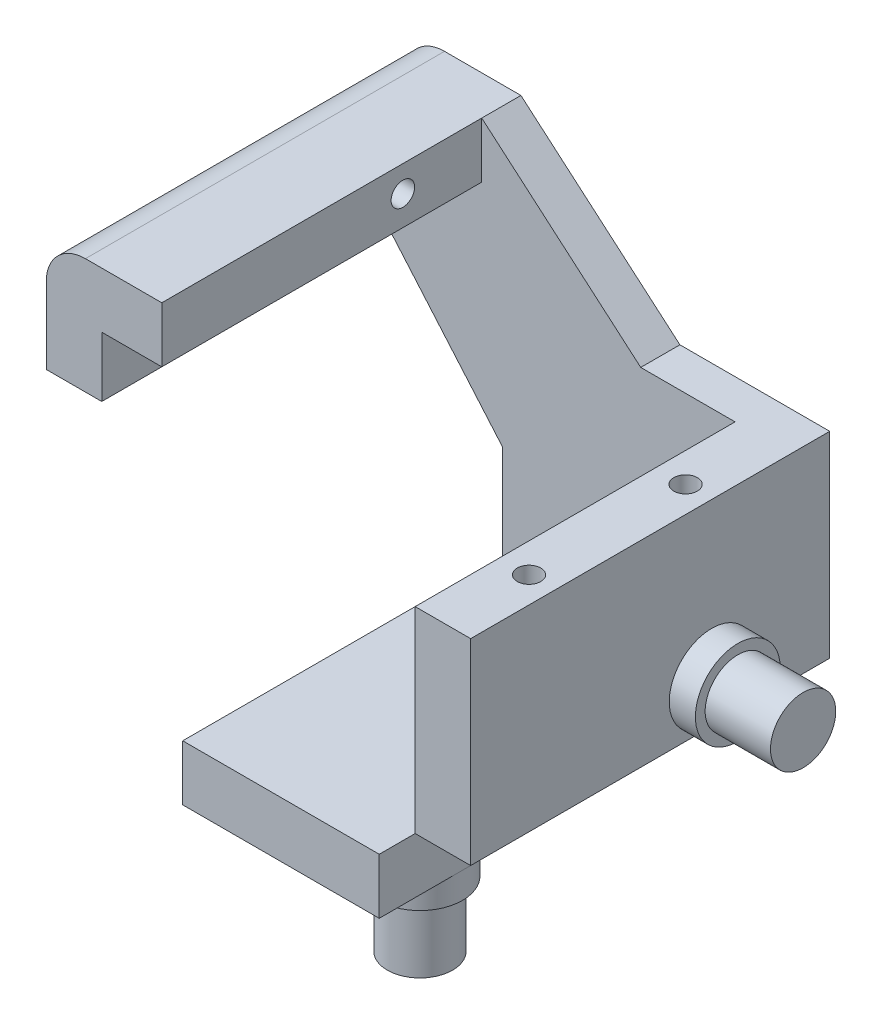
from build123d import *

# Parameters (mm, degrees)
EXTRUDE_1_DEPTH      = 27.5
SKETCH_3_W           = 24
SKETCH_3_H           = 24
CUT_EXTRUDE_3_DEPTH  = 24.5
CUT_EXTRUDE_4_DEPTH  = 24.5
SKETCH_7_R           = 3.25
EXTRUDE_4_DEPTH      = 2
SKETCH_10_R          = 3.25
EXTRUDE_5_DEPTH      = 2
CUT_EXTRUDE_6_DEPTH  = 27.5
CUT_EXTRUDE_7_DEPTH  = 3
SKETCH_16_R          = 0.9
CUT_EXTRUDE_10_DEPTH = 6
SKETCH_20_R          = 2.5
EXTRUDE_6_DEPTH      = 5
SKETCH_19_R          = 2.5
EXTRUDE_7_DEPTH      = 5
SKETCH_17_R          = 0.9
CUT_EXTRUDE_11_DEPTH = 6
SKETCH_21_R          = 0.9
CUT_EXTRUDE_12_DEPTH = 6


with BuildPart() as part:
    # 草图1 → 凸台-拉伸1 (new body)
    with BuildSketch(Plane.XY):
        with BuildLine():
            Line((-16.25, -16.25), (16.25, -16.25))
            Line((16.25, -16.25), (16.25, 16.25))
            Line((16.25, 16.25), (-13.25, 16.25))
            ThreePointArc((-13.25, 16.25), (-15.371320344, 15.371320344), (-16.25, 13.25))
            Line((-16.25, 13.25), (-16.25, -16.25))
        make_face()
    extrude(amount=EXTRUDE_1_DEPTH)

    # 草图3 → 切除-拉伸3 (cut)
    with BuildSketch(Plane.XY.offset(27.5)):
        Rectangle(SKETCH_3_W, SKETCH_3_H)
    extrude(amount=-CUT_EXTRUDE_3_DEPTH, mode=Mode.SUBTRACT)

    # 草图4 → 切除-拉伸4 (cut)
    with BuildSketch(Plane.XY.offset(27.5)):
        Polygon((16.25, 16.25), (-7.4, 16.25), (-7.4, 12), (-0.175, 5.8), (16.25, 5.8), align=None)
    cut_extrude_4 = extrude(amount=-CUT_EXTRUDE_4_DEPTH, mode=Mode.SUBTRACT)

    # 镜向1: 切除-拉伸4 across plane
    add(cut_extrude_4.mirror(Plane(origin=(0, 0, 0), x_dir=(0, 0, 1), z_dir=(0.7071067811865477, 0.7071067811865475, 0))), mode=Mode.SUBTRACT)

    # 草图7 → 凸台-拉伸4 (add)
    with BuildSketch(Plane.XZ.offset(16.25)):
        with Locations(Location((6, 21.13, 0), (0, 0, 90))):
            Circle(SKETCH_7_R)
    extrude(amount=EXTRUDE_4_DEPTH)

    # 草图10 → 凸台-拉伸5 (add)
    with BuildSketch(Plane(origin=(16.25, 0, 0), x_dir=(0, 0, -1), z_dir=(1, 0, 0))):
        with Locations(Location((-9.04, -6, 0), (0, 0, 180))):
            Circle(SKETCH_10_R)
    extrude(amount=EXTRUDE_5_DEPTH)

    # 草图13 → 切除-拉伸6 (cut)
    with BuildSketch(Plane.XY.offset(27.5)):
        with BuildLine():
            Line((16.25, -16.25), (9.25, -16.25))
            Line((9.25, -16.25), (9.25, -12))
            ThreePointArc((9.25, -12), (10.055456352, -10.055456352), (12, -9.25))
            Line((12, -9.25), (16.25, -9.25))
            Line((16.25, -9.25), (16.25, -16.25))
        make_face()
    extrude(amount=-CUT_EXTRUDE_6_DEPTH, mode=Mode.SUBTRACT)

    # 草图14 → 切除-拉伸7 (cut)
    with BuildSketch(Plane.XY.offset(3)):
        Polygon((16.25, 5.8), (4.775755008, 5.8), (-7.4, 16.25), (16.25, 16.25), align=None)
    cut_extrude_7 = extrude(amount=-CUT_EXTRUDE_7_DEPTH, mode=Mode.SUBTRACT)

    # 镜向3: 切除-拉伸7 across plane
    add(cut_extrude_7.mirror(Plane(origin=(0, 0, 0), x_dir=(0, 0, 1), z_dir=(0.7071067811865477, 0.7071067811865475, 0))), mode=Mode.SUBTRACT)

    # 草图16 → 切除-拉伸10 (cut)
    with BuildSketch(Plane(origin=(0, 5.8, 0), x_dir=(1, 0, 0), z_dir=(0, 1, 0))):
        with Locations(Location((14.25, -9.04, 0), (0, 0, 180))):
            Circle(SKETCH_16_R)
        with Locations(Location((14.25, -21.03, 0), (0, 0, 180))):
            Circle(SKETCH_16_R)
    cut_extrude_10 = extrude(amount=-CUT_EXTRUDE_10_DEPTH, mode=Mode.SUBTRACT)

    # 镜向4: 切除-拉伸10 across plane
    add(cut_extrude_10.mirror(Plane(origin=(0, 0, 0), x_dir=(0, 0, 1), z_dir=(0.7071067811865477, 0.7071067811865475, 0))), mode=Mode.SUBTRACT)

    # 草图20 → 凸台-拉伸6 (add)
    with BuildSketch(Plane.XZ.offset(18.25)):
        with Locations(Location((6, 21.13, 0), (0, 0, 270))):
            Circle(SKETCH_20_R)
    extrude(amount=EXTRUDE_6_DEPTH)

    # 草图19 → 凸台-拉伸7 (add)
    with BuildSketch(Plane(origin=(18.25, 0, 0), x_dir=(0, 0, -1), z_dir=(1, 0, 0))):
        with Locations((-9.04, -6)):
            Circle(SKETCH_19_R)
    extrude(amount=EXTRUDE_7_DEPTH)

    # 草图17 → 切除-拉伸11 (cut)
    with BuildSketch(Plane(origin=(-7.4, 0, 0), x_dir=(0, 0, -1), z_dir=(1, 0, 0))):
        with Locations((-9.04, 14.25)):
            Circle(SKETCH_17_R)
    extrude(amount=-CUT_EXTRUDE_11_DEPTH, mode=Mode.SUBTRACT)

    # 草图21 → 切除-拉伸12 (cut)
    with BuildSketch(Plane(origin=(0, 7.4, 0), x_dir=(-1, 0, 0), z_dir=(0, -1, 0))):
        with Locations(Location((14.25, -21.03, 0), (0, 0, 180))):
            Circle(SKETCH_21_R)
    extrude(amount=-CUT_EXTRUDE_12_DEPTH, mode=Mode.SUBTRACT)


solid = part.part
